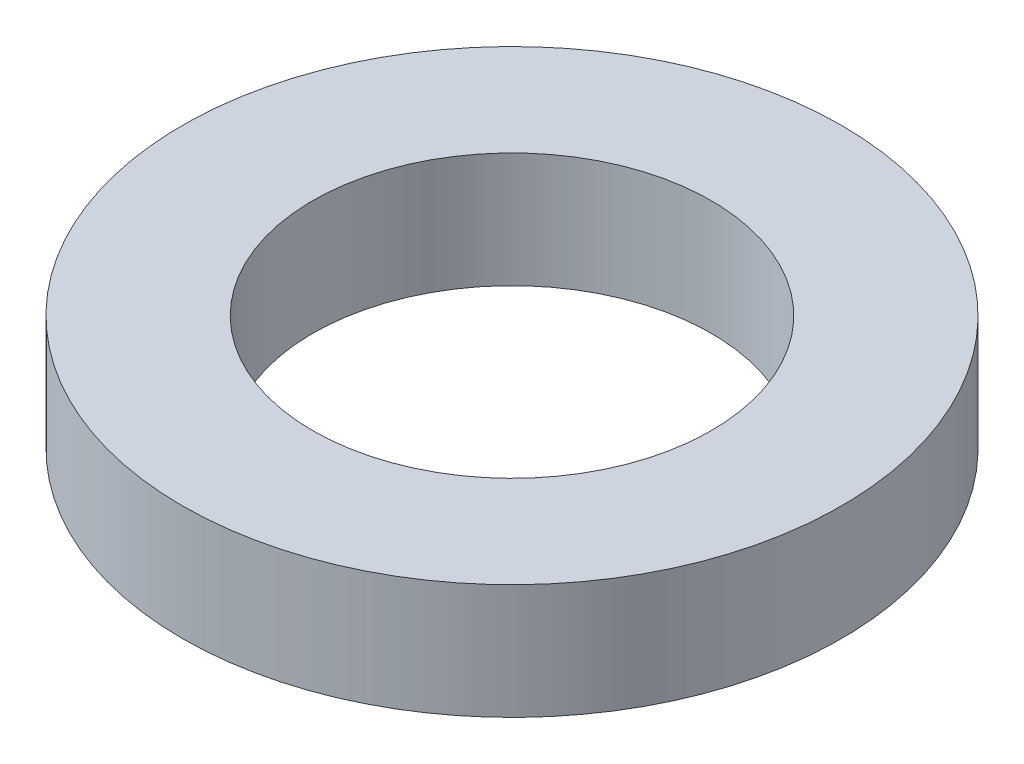
from build123d import *

# Parameters (mm, degrees)
SKETCH2_R           = 43
BOSS_EXTRUDE1_DEPTH = 15
SKETCH3_R           = 26
CUT_EXTRUDE1_DEPTH  = 15


with BuildPart() as part:
    # Sketch2 → Boss-Extrude1 (new body)
    with BuildSketch(Plane(origin=(0, 0, 0), x_dir=(1, 0, 0), z_dir=(0, 1, 0))):
        with Locations(Location((0, 0, 0), (0, 0, 270))):
            Circle(SKETCH2_R)
    extrude(amount=BOSS_EXTRUDE1_DEPTH)

    # Sketch3 → Cut-Extrude1 (cut)
    with BuildSketch(Plane(origin=(0, 15, 0), x_dir=(1, 0, 0), z_dir=(0, 1, 0))):
        with Locations(Location((0, 0, 0), (0, 0, 270))):
            Circle(SKETCH3_R)
    extrude(amount=-CUT_EXTRUDE1_DEPTH, mode=Mode.SUBTRACT)


solid = part.part
